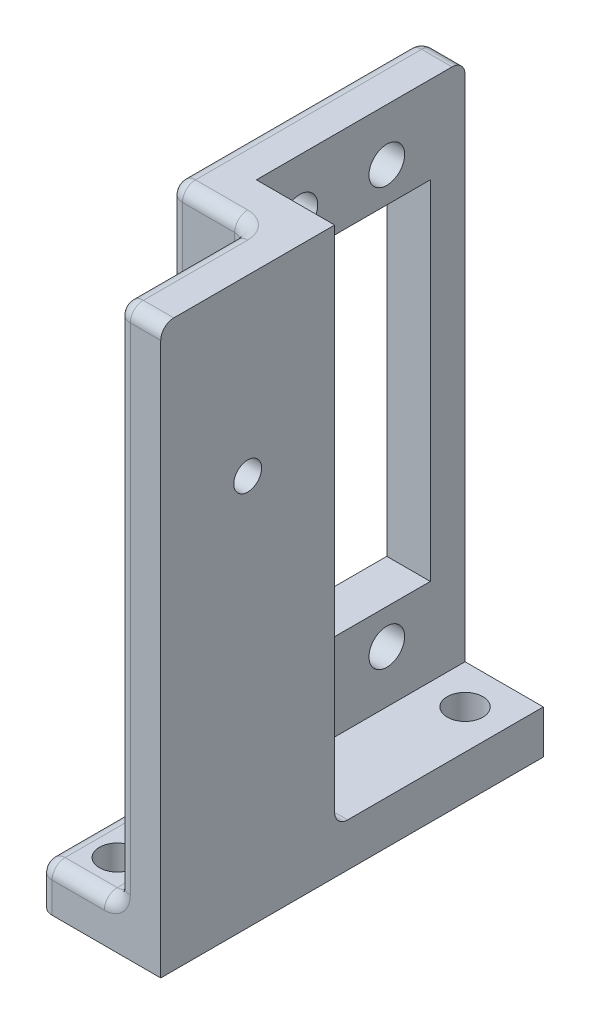
from build123d import *

# Parameters (mm, degrees)
ESQUISSE5_W                  = 14
ESQUISSE5_H                  = 44
BOSS_EXTRU_2_DEPTH           = 5
BOSS_EXTRU_3_DEPTH           = 60
ENL_V_MAT_EXTRU_2_DEPTH      = 80.730797061
ENL_V_MAT_EXTRU_2_DEPTH_BACK = 80.730797061
ESQUISSE8_R                  = 1.6
ESQUISSE10_R                 = 2.05
ESQUISSE10_W                 = 20
ESQUISSE10_H                 = 40
ESQUISSE10_R_2               = 1.6
ENL_V_MAT_EXTRU_3_DEPTH      = 80.730797061
ESQUISSE11_R                 = 2.05
ENL_V_MAT_EXTRU_4_DEPTH      = 76.709972923
CONG_3_R                     = 1.5


with BuildPart() as part:
    # Esquisse5 → Boss.-Extru.2 (new body)
    with BuildSketch(Plane(origin=(0, 0, 0), x_dir=(1, 0, 0), z_dir=(0, 1, 0))):
        with Locations((7, 22)):
            Rectangle(ESQUISSE5_W, ESQUISSE5_H)
    extrude(amount=BOSS_EXTRU_2_DEPTH)

    # Esquisse6 → Boss.-Extru.3 (add)
    with BuildSketch(Plane(origin=(0, 5, 0), x_dir=(1, 0, 0), z_dir=(0, 1, 0))):
        Polygon((9, 15), (9, 0), (14, 0), (14, 20), (5, 20), (5, 44), (0, 44), (0, 15), align=None)
    extrude(amount=BOSS_EXTRU_3_DEPTH)

    # Esquisse8 → Enlèv. mat.-Extru.2 (cut, two sides: drawn at the far end of the back side and taken through both)
    with BuildSketch(Plane(origin=(0, 0, 0), x_dir=(0, 0, -1), z_dir=(1, 0, 0)).offset(-ENL_V_MAT_EXTRU_2_DEPTH_BACK)):
        with Locations((30, 25)):
            Circle(ESQUISSE8_R)
        with Locations((10, 45)):
            Circle(ESQUISSE8_R)
    extrude(amount=ENL_V_MAT_EXTRU_2_DEPTH + ENL_V_MAT_EXTRU_2_DEPTH_BACK, mode=Mode.SUBTRACT)

    # Esquisse10 → Enlèv. mat.-Extru.3 (cut, through all)
    # profile 1 of 5: a face of its own
    with BuildSketch(Plane.ZY):
        with Locations((-25, 11)):
            Circle(ESQUISSE10_R)
    # profile 2 of 5: a face of its own
    with BuildSketch(Plane.ZY):
        with Locations((-35, 11)):
            Circle(ESQUISSE10_R)
    # profile 3 of 5: a face of its own
    with BuildSketch(Plane.ZY):
        with Locations((-30, 35)):
            Rectangle(ESQUISSE10_W, ESQUISSE10_H)
        with Locations((-30, 25)):
            Circle(ESQUISSE10_R_2, mode=Mode.SUBTRACT)
    # profile 4 of 5: a face of its own
    with BuildSketch(Plane.ZY):
        with Locations((-25, 59)):
            Circle(ESQUISSE10_R)
    # profile 5 of 5: a face of its own
    with BuildSketch(Plane.ZY):
        with Locations((-35, 59)):
            Circle(ESQUISSE10_R)
    extrude(amount=-ENL_V_MAT_EXTRU_3_DEPTH, mode=Mode.SUBTRACT)

    # Esquisse11 → Enlèv. mat.-Extru.4 (cut, through all)
    with BuildSketch(Plane(origin=(0, 5, 0), x_dir=(1, 0, 0), z_dir=(0, 1, 0))):
        with Locations(Location((9.5, 39.5, 0), (0, 0, 270))):
            Circle(ESQUISSE11_R)
        with Locations(Location((4.5, 4.5, 0), (0, 0, 270))):
            Circle(ESQUISSE11_R)
    extrude(amount=-ENL_V_MAT_EXTRU_4_DEPTH, mode=Mode.SUBTRACT)

    # Congé3
    cong_3_edges = [part.edges().sort_by_distance(p)[0] for p in [
        (0, 5, -7.5),
        (4.5, 65, -15),
        (0, 35, -15),
        (9, 65, -7.5),
        (9, 35, -15),
        (9, 35, 0),
        (2.5, 65, -44),
        (0, 65, -29.5),
        (11.5, 65, 0),
        (9.5, 5, -20),
        (9, 5, -7.5),
        (4.5, 5, -15),
        (4.5, 5, 0),
        (0, 2.5, 0),
        (0, 32.5, -44),
    ]]
    fillet(cong_3_edges, radius=CONG_3_R)


solid = part.part
